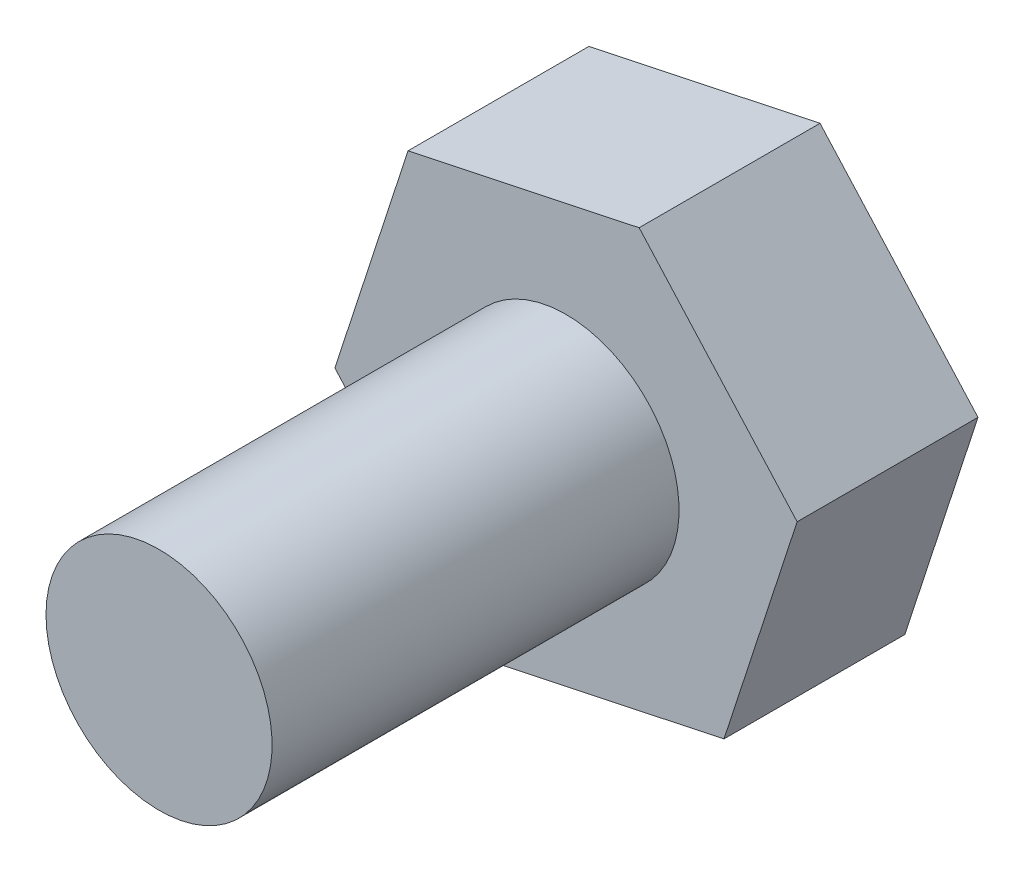
from build123d import *

# Parameters (mm, degrees)
SKETCH1_R           = 2.5
BOSS_EXTRUDE3_DEPTH = 4
SKETCH2_R           = 2.5
BOSS_EXTRUDE4_DEPTH = 13


with BuildPart() as part:
    # Sketch1 → Boss-Extrude3 (new body)
    with BuildSketch(Plane.XY):
        Polygon((3.493859283, -3.885138771), (5.111558514, 1.08320151), (1.617699232, 4.968340281), (-3.493859283, 3.885138771), (-5.111558514, -1.08320151), (-1.617699232, -4.968340281), align=None)
        Circle(SKETCH1_R, mode=Mode.SUBTRACT)
    extrude(amount=BOSS_EXTRUDE3_DEPTH)

    # Sketch2 → Boss-Extrude4 (add)
    with BuildSketch(Plane(origin=(0, 0, 0), x_dir=(-1, 0, 0), z_dir=(0, 0, -1))):
        Circle(SKETCH2_R)
    extrude(amount=-BOSS_EXTRUDE4_DEPTH)


solid = part.part
